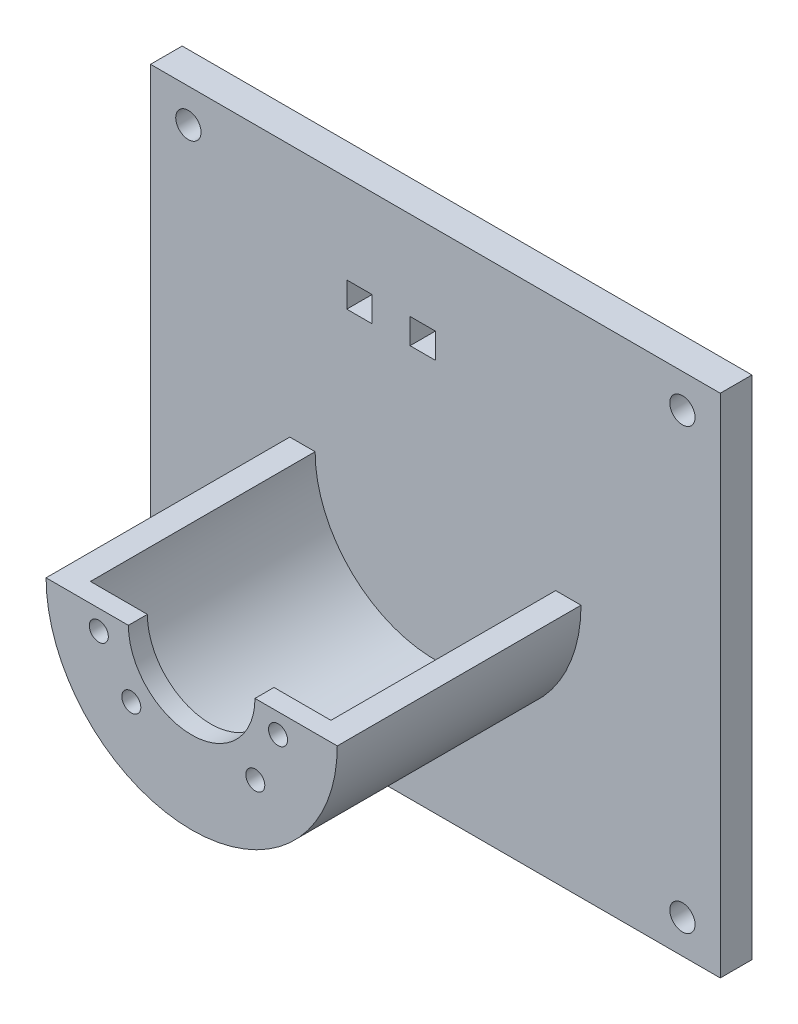
from build123d import *

# Parameters (mm, degrees)
BOSS_EXTRUDE1_DEPTH = 35.5
BOSS_EXTRUDE2_START = 5
SKETCH2_W           = 90
SKETCH2_H           = 80
SKETCH2_R           = 2
BOSS_EXTRUDE2_DEPTH = 5
BOSS_EXTRUDE3_DEPTH = 3
SKETCH4_R           = 1.5
CUT_EXTRUDE1_DEPTH  = 3
SKETCH5_W           = 4
SKETCH5_H           = 4
CUT_EXTRUDE2_DEPTH  = 72.465026412


with BuildPart() as part:
    # Sketch1 → Boss-Extrude1 (new body)
    with BuildSketch(Plane.XY):
        with BuildLine():
            Line((-23, 0), (-19, 0))
            ThreePointArc((-19, 0), (0, -19), (19, 0))
            Line((19, 0), (23, 0))
            ThreePointArc((23, 0), (0, -23), (-23, 0))
        make_face()
    extrude(amount=BOSS_EXTRUDE1_DEPTH)

    # Sketch2 → Boss-Extrude2 (add)
    # profile 1 of 2: a face of its own
    with BuildSketch(Plane(origin=(0, 0, 0), x_dir=(-1, 0, 0), z_dir=(0, 0, -1)).offset(BOSS_EXTRUDE2_START)):
        Rectangle(SKETCH2_W, SKETCH2_H)
        with Locations((39.020725451, 34.685089289)):
            Circle(SKETCH2_R, mode=Mode.SUBTRACT)
        with Locations((-39.020725451, 34.685089289)):
            Circle(SKETCH2_R, mode=Mode.SUBTRACT)
        with Locations((39.020725451, -34.685089289)):
            Circle(SKETCH2_R, mode=Mode.SUBTRACT)
        with Locations((-39.020725451, -34.685089289)):
            Circle(SKETCH2_R, mode=Mode.SUBTRACT)
        with BuildLine():
            Line((23, 0), (19, 0))
            ThreePointArc((19, 0), (0, -19), (-19, 0))
            Line((-19, 0), (-23, 0))
            ThreePointArc((-23, 0), (0, -23), (23, 0))
        make_face(mode=Mode.SUBTRACT)
    # profile 2 of 2: a face of its own
    with BuildSketch(Plane(origin=(0, 0, 0), x_dir=(-1, 0, 0), z_dir=(0, 0, -1)).offset(BOSS_EXTRUDE2_START)):
        with BuildLine():
            ThreePointArc((-23, 0), (0, -23), (23, 0))
            Line((23, 0), (19, 0))
            ThreePointArc((19, 0), (0, -19), (-19, 0))
            Line((-19, 0), (-23, 0))
        make_face()
    extrude(amount=-BOSS_EXTRUDE2_DEPTH)

    # Sketch3 → Boss-Extrude3 (add)
    with BuildSketch(Plane.XY.offset(35.5)):
        with BuildLine():
            Line((-23, 0), (-10, 0))
            ThreePointArc((-10, 0), (0, -10), (10, 0))
            Line((10, 0), (23, 0))
            ThreePointArc((23, 0), (0, -23), (-23, 0))
        make_face()
    extrude(amount=BOSS_EXTRUDE3_DEPTH)

    # Sketch4 → Cut-Extrude1 (cut)
    with BuildSketch(Plane.XY.offset(38.5)):
        with Locations((-9.536891354, -10.249278184)):
            Circle(SKETCH4_R)
        with Locations((13.644580955, -3.134551093)):
            Circle(SKETCH4_R)
        with Locations((10.049016147, -11.136304346)):
            Circle(SKETCH4_R)
        with Locations((-14.668830541, -3.134551093)):
            Circle(SKETCH4_R)
    extrude(amount=-CUT_EXTRUDE1_DEPTH, mode=Mode.SUBTRACT)

    # Sketch5 → Cut-Extrude2 (cut, through all)
    with BuildSketch(Plane.XY):
        with Locations((-12, 24)):
            Rectangle(SKETCH5_W, SKETCH5_H)
        with Locations((-2, 24)):
            Rectangle(SKETCH5_W, SKETCH5_H)
    extrude(amount=-CUT_EXTRUDE2_DEPTH, mode=Mode.SUBTRACT)


solid = part.part
